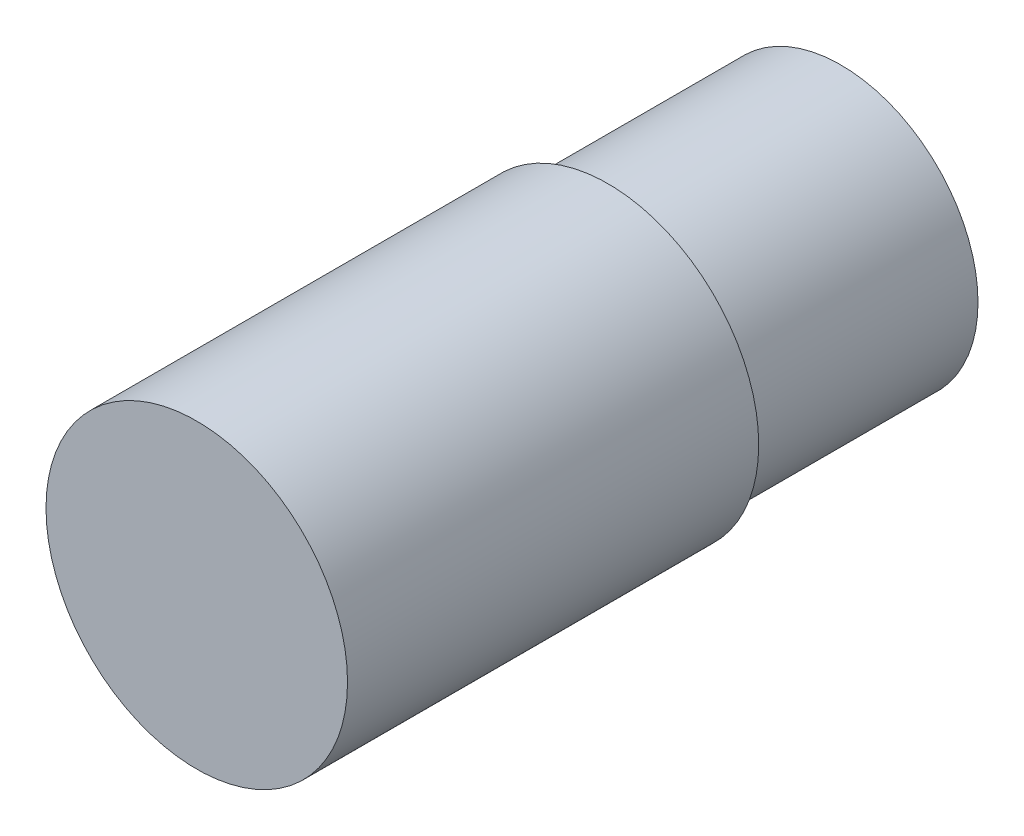
from build123d import *

# Parameters (mm, degrees)
SKETCH1_R           = 10
BOSS_EXTRUDE1_DEPTH = 17
SKETCH2_R           = 11
BOSS_EXTRUDE2_DEPTH = 30


with BuildPart() as part:
    # Sketch1 → Boss-Extrude1 (new body)
    with BuildSketch(Plane.XY):
        Circle(SKETCH1_R)
    extrude(amount=BOSS_EXTRUDE1_DEPTH)

    # Sketch2 → Boss-Extrude2 (add)
    with BuildSketch(Plane.XY.offset(17)):
        Circle(SKETCH2_R)
    extrude(amount=BOSS_EXTRUDE2_DEPTH)


solid = part.part
